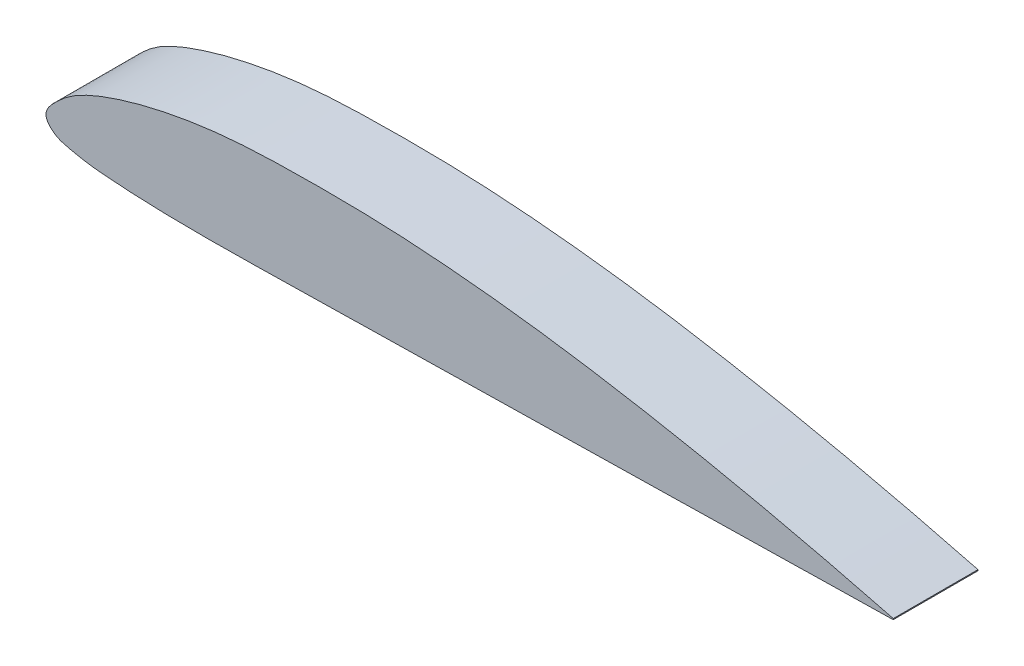
from build123d import *

# Parameters (mm, degrees)
BOSS_EXTRUDE2_DEPTH = 2.54


with BuildPart() as part:
    # Sketch3 → Boss-Extrude2 (new body)
    with BuildSketch(Plane.XY):
        with BuildLine():
            Line((36.024411623, 8.833891622), (36.02388056, 8.803467057))
            add(Edge.make_bspline(
                [(36.024411623, 8.833891622), (35.940110388, 8.855441356), (35.771519255, 8.898537925), (35.518615007, 8.963011805), (35.265722854, 9.027266219), (34.928591121, 9.112272012), (34.507172005, 9.217078304), (34.0012213, 9.339997501), (33.495215114, 9.460214811), (32.989199058, 9.577983136), (32.48313133, 9.693135775), (31.977026869, 9.805653875), (31.470852828, 9.915324305), (30.964653802, 10.022269088), (30.458375988, 10.126193468), (29.952067877, 10.227262376), (29.44568476, 10.325243801), (28.939267234, 10.420306964), (28.432789251, 10.512294848), (27.926270226, 10.601216532), (27.419705617, 10.686879037), (26.91305893, 10.768830199), (26.406356054, 10.846953058), (25.899561465, 10.920786933), (25.224054974, 11.013250433), (24.548014145, 11.096644584), (23.871545959, 11.170908369), (23.364343088, 11.222018928), (22.857065854, 11.268521755), (22.180782102, 11.323982016), (21.504055467, 11.368723765), (20.826979629, 11.401145483), (20.319167901, 11.41883215), (19.811254634, 11.430314504), (19.303250194, 11.436051563), (18.795163182, 11.436684193), (18.287001233, 11.432544236), (17.778727325, 11.424559687), (17.270296965, 11.410509235), (16.7616525, 11.387972978), (16.252737458, 11.354348129), (15.743486133, 11.30718323), (15.234022462, 11.243599524), (14.724342336, 11.163441883), (14.21424305, 11.067344935), (13.703535389, 10.954250255), (13.192219549, 10.820713303), (12.680544889, 10.662337201), (12.254293529, 10.509950861), (11.914178011, 10.36552408), (11.656131189, 10.239055252), (11.39535284, 10.087990772), (11.153946026, 9.910615464), (10.972021943, 9.741461387), (10.833033212, 9.605377467), (10.744537646, 9.505661086), (10.685985365, 9.419533646), (10.657092351, 9.362948091), (10.638413815, 9.314088843), (10.621042049, 9.243327339), (10.627957303, 9.169257678), (10.652558737, 9.104459717), (10.679303152, 9.052806078), (10.734126026, 8.977230661), (10.818328295, 8.896678267), (10.950232943, 8.804001665), (11.13837206, 8.727513541), (11.379153173, 8.674613085), (11.632053685, 8.61971888), (11.885521076, 8.576496999), (12.223550281, 8.534677341), (12.646862058, 8.502929726), (13.154399589, 8.469933459), (13.662167573, 8.446563589), (14.170024357, 8.430820118), (14.677982199, 8.421744425), (15.186018626, 8.418305106), (15.863538003, 8.419675757), (16.541106898, 8.427983487), (17.218695237, 8.440114735), (17.726938158, 8.450303495), (18.23518743, 8.46092624), (18.743442215, 8.471161301), (19.251695171, 8.480990448), (19.759942312, 8.490698241), (20.268189365, 8.500230588), (20.77643495, 8.50982429), (21.284681138, 8.519500241), (21.792928839, 8.529242869), (22.301176315, 8.539093642), (22.80942585, 8.548902184), (23.317674207, 8.558771637), (23.825923203, 8.568591963), (24.334171589, 8.578395578), (25.181252155, 8.594674282), (26.02833189, 8.610980061), (27.044828845, 8.630513114), (27.722491994, 8.643623139), (28.40015748, 8.656627994), (28.908404839, 8.666452604), (29.416653948, 8.676202468), (29.924901288, 8.68602809), (30.433150402, 8.695777683), (30.94139774, 8.705603378), (31.449646855, 8.715352951), (31.957894193, 8.725178651), (32.466143308, 8.734928221), (32.974390646, 8.744753928), (33.482639762, 8.754503476), (33.990887098, 8.764329267), (34.499136219, 8.774078498), (34.922675699, 8.782267643), (35.261508136, 8.788777883), (35.515632072, 8.79366878), (35.769756558, 8.798547339), (35.939172456, 8.801827149), (36.02388056, 8.803467057)],
                knots=[0, 0, 0, 0, 0.005027835, 0.010054994, 0.01508103, 0.020105055, 0.030145261, 0.040173646, 0.050190794, 0.06019768, 0.070194226, 0.080180377, 0.09015591, 0.100121106, 0.110075703, 0.120020101, 0.129954271, 0.139878706, 0.149793491, 0.159698811, 0.169594433, 0.179479778, 0.189354744, 0.199219015, 0.209072795, 0.228751158, 0.238577242, 0.248395636, 0.258207018, 0.268011852, 0.287604023, 0.297393127, 0.307179253, 0.316964018, 0.326748819, 0.336534715, 0.346322474, 0.356112722, 0.365907652, 0.375711463, 0.385530879, 0.395375762, 0.405259305, 0.415192461, 0.425184025, 0.435248335, 0.445412191, 0.455710779, 0.466190959, 0.471552192, 0.477054504, 0.482786727, 0.488945835, 0.494316033, 0.497126416, 0.500187368, 0.502000869, 0.503128202, 0.503849971, 0.505020137, 0.507317905, 0.507986558, 0.509023586, 0.510668219, 0.513358348, 0.515715812, 0.519949385, 0.524973188, 0.5299544, 0.534903202, 0.539824123, 0.549630394, 0.559425369, 0.569214167, 0.578999733, 0.588784364, 0.598569511, 0.608355933, 0.627933315, 0.637723968, 0.6475154, 0.657307127, 0.667098669, 0.676889956, 0.686681117, 0.69647219, 0.70626328, 0.716054423, 0.72584562, 0.735636871, 0.745428122, 0.755219391, 0.765010642, 0.774801875, 0.78459309, 0.813966735, 0.82375795, 0.843340416, 0.853131631, 0.862922864, 0.872714079, 0.882505312, 0.892296527, 0.90208776, 0.911878975, 0.921670208, 0.931461423, 0.941252656, 0.951043871, 0.960835104, 0.970626319, 0.980417552, 0.98531316, 0.990208767, 0.995104375, 1, 1, 1, 1], degree=3))
        make_face()
    extrude(amount=BOSS_EXTRUDE2_DEPTH)


solid = part.part
